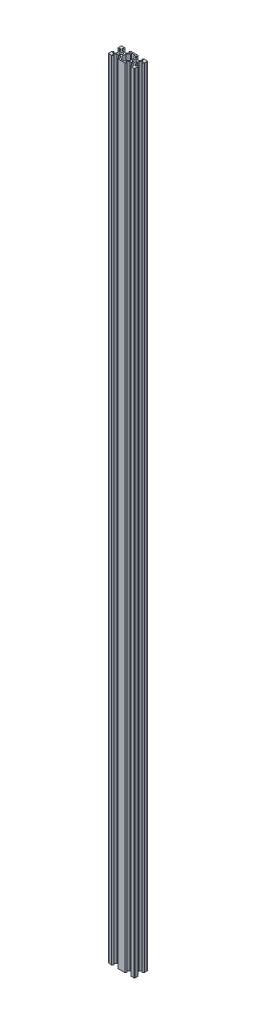
from build123d import *

# Parameters (mm, degrees)
SKETCH13_R                                  = 2.5
RETANGULAR_PF20_12_PERFIL_2040_V_SLOT_DEPTH = 1200


with BuildPart() as part:
    # Sketch13 → Retangular PF20-12 - PERFIL 2040 V-SLOT(1) (new body)
    with BuildSketch(Plane(origin=(0, 0, 0), x_dir=(-1, 0, 0), z_dir=(0, 1, 0))):
        with BuildLine():
            Line((-14.8, 10), (-13, 8.2))
            Line((-13, 8.2), (-15.5, 8.2))
            Line((-15.5, 8.2), (-15.5, 6.560660172))
            Line((-15.5, 6.560660172), (-12.939339828, 4))
            Line((-12.939339828, 4), (-10.3, 4))
            Line((-10.3, 4), (-10, 3.7))
            Line((-10, 3.7), (-9.7, 4))
            Line((-9.7, 4), (-7.060660172, 4))
            Line((-7.060660172, 4), (-4.5, 6.560660172))
            Line((-4.5, 6.560660172), (-4.5, 8.2))
            Line((-4.5, 8.2), (-7, 8.2))
            Line((-7, 8.2), (-5.2, 10))
            Line((-5.2, 10), (5.2, 10))
            Line((5.2, 10), (7, 8.2))
            Line((7, 8.2), (4.5, 8.2))
            Line((4.5, 8.2), (4.5, 6.560660172))
            Line((4.5, 6.560660172), (7.060660172, 4))
            Line((7.060660172, 4), (9.7, 4))
            Line((9.7, 4), (10, 3.7))
            Line((10, 3.7), (10.3, 4))
            Line((10.3, 4), (12.939339828, 4))
            Line((12.939339828, 4), (15.5, 6.560660172))
            Line((15.5, 6.560660172), (15.5, 8.2))
            Line((15.5, 8.2), (13, 8.2))
            Line((13, 8.2), (14.8, 10))
            Line((14.8, 10), (19, 10))
            ThreePointArc((19, 10), (19.707106781, 9.707106781), (20, 9))
            Line((20, 9), (20, 4.8))
            Line((20, 4.8), (18.2, 3))
            Line((18.2, 3), (18.2, 5.5))
            Line((18.2, 5.5), (16.560660172, 5.5))
            Line((16.560660172, 5.5), (14, 2.939339828))
            Line((14, 2.939339828), (14, 0.3))
            Line((14, 0.3), (13.7, 0))
            Line((13.7, 0), (14, -0.3))
            Line((14, -0.3), (14, -2.939339828))
            Line((14, -2.939339828), (16.560660172, -5.5))
            Line((16.560660172, -5.5), (18.2, -5.5))
            Line((18.2, -5.5), (18.2, -3))
            Line((18.2, -3), (20, -4.8))
            Line((20, -4.8), (20, -9))
            ThreePointArc((20, -9), (19.707106781, -9.707106781), (19, -10))
            Line((19, -10), (14.8, -10))
            Line((14.8, -10), (13, -8.2))
            Line((13, -8.2), (15.5, -8.2))
            Line((15.5, -8.2), (15.5, -6.560660172))
            Line((15.5, -6.560660172), (12.939339828, -4))
            Line((12.939339828, -4), (10.3, -4))
            Line((10.3, -4), (10, -3.7))
            Line((10, -3.7), (9.7, -4))
            Line((9.7, -4), (7.060660172, -4))
            Line((7.060660172, -4), (4.5, -6.560660172))
            Line((4.5, -6.560660172), (4.5, -8.2))
            Line((4.5, -8.2), (7, -8.2))
            Line((7, -8.2), (5.2, -10))
            Line((5.2, -10), (-5.2, -10))
            Line((-5.2, -10), (-7, -8.2))
            Line((-7, -8.2), (-4.5, -8.2))
            Line((-4.5, -8.2), (-4.5, -6.560660172))
            Line((-4.5, -6.560660172), (-7.060660172, -4))
            Line((-7.060660172, -4), (-9.7, -4))
            Line((-9.7, -4), (-10, -3.7))
            Line((-10, -3.7), (-10.3, -4))
            Line((-10.3, -4), (-12.939339828, -4))
            Line((-12.939339828, -4), (-15.5, -6.560660172))
            Line((-15.5, -6.560660172), (-15.5, -8.2))
            Line((-15.5, -8.2), (-13, -8.2))
            Line((-13, -8.2), (-14.8, -10))
            Line((-14.8, -10), (-19, -10))
            ThreePointArc((-19, -10), (-19.707106781, -9.707106781), (-20, -9))
            Line((-20, -9), (-20, -4.8))
            Line((-20, -4.8), (-18.2, -3))
            Line((-18.2, -3), (-18.2, -5.5))
            Line((-18.2, -5.5), (-16.560660172, -5.5))
            Line((-16.560660172, -5.5), (-14, -2.939339828))
            Line((-14, -2.939339828), (-14, -0.3))
            Line((-14, -0.3), (-13.7, 0))
            Line((-13.7, 0), (-14, 0.3))
            Line((-14, 0.3), (-14, 2.939339828))
            Line((-14, 2.939339828), (-16.560660172, 5.5))
            Line((-16.560660172, 5.5), (-18.2, 5.5))
            Line((-18.2, 5.5), (-18.2, 3))
            Line((-18.2, 3), (-20, 4.8))
            Line((-20, 4.8), (-20, 9))
            ThreePointArc((-20, 9), (-19.707106781, 9.707106781), (-19, 10))
            Line((-19, 10), (-14.8, 10))
        make_face()
        with Locations((-10, 0)):
            Circle(SKETCH13_R, mode=Mode.SUBTRACT)
        with Locations((10, 0)):
            Circle(SKETCH13_R, mode=Mode.SUBTRACT)
        Polygon((-2.7, 8.2), (-2.7, 6.239339828), (-6, 2.939339828), (-6, -2.939339828), (-2.7, -6.239339828), (-2.7, -8.2), (2.7, -8.2), (2.7, -6.239339828), (6, -2.939339828), (6, 2.939339828), (2.7, 6.239339828), (2.7, 8.2), align=None, mode=Mode.SUBTRACT)
    extrude(amount=RETANGULAR_PF20_12_PERFIL_2040_V_SLOT_DEPTH)


solid = part.part
